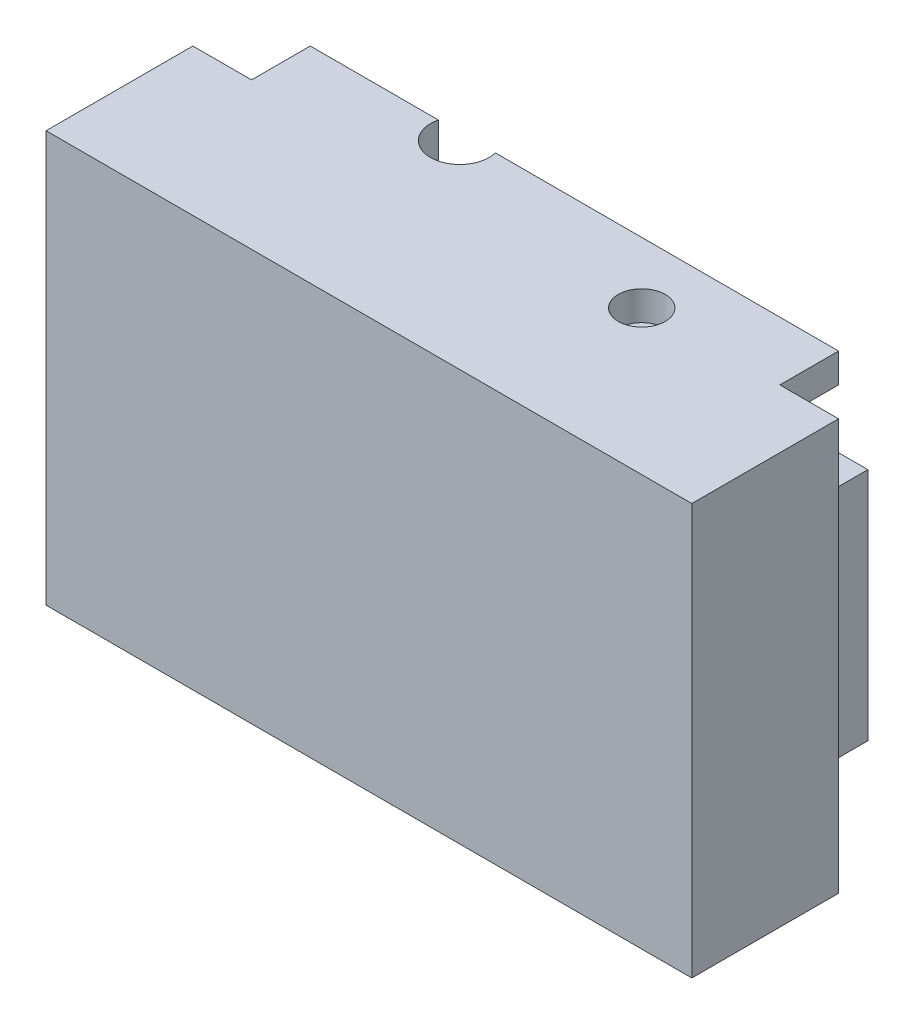
from build123d import *

# Parameters (mm, degrees)
SKETCH1_W           = 110
SKETCH1_H           = 70
BOSS_EXTRUDE1_DEPTH = 5
SKETCH2_W           = 90
SKETCH2_H           = 10
BOSS_EXTRUDE2_DEPTH = 20
BOSS_EXTRUDE5_DEPTH = 10
SKETCH7_R           = 5
CUT_EXTRUDE2_DEPTH  = 10
SKETCH8_R           = 4
CUT_EXTRUDE3_DEPTH  = 5
SKETCH9_W           = 5
SKETCH9_H           = 40
BOSS_EXTRUDE6_DEPTH = 10
SKETCH10_W          = 90
SKETCH10_H          = 10.075231777
BOSS_EXTRUDE7_DEPTH = 10
SKETCH11_W          = 40
SKETCH11_H          = 10
CUT_EXTRUDE4_DEPTH  = 5


with BuildPart() as part:
    # Sketch1 → Boss-Extrude1 (new body)
    with BuildSketch(Plane.XY):
        with Locations((55, 35)):
            Rectangle(SKETCH1_W, SKETCH1_H)
    extrude(amount=BOSS_EXTRUDE1_DEPTH)

    # Sketch2 → Boss-Extrude2 (add)
    with BuildSketch(Plane(origin=(0, 0, 0), x_dir=(-1, 0, 0), z_dir=(0, 0, -1))):
        with Locations((-55, 65)):
            Rectangle(SKETCH2_W, SKETCH2_H)
        Polygon((-100, 70), (-110, 70), (-110, 0), (-100, 0), (-100, 10), (-100, 60), align=None)
        Polygon((0, 70), (-10, 70), (-10, 60), (-10, 10), (-10, 0), (0, 0), align=None)
        with Locations((-55, 5)):
            Rectangle(SKETCH2_W, SKETCH2_H)
    extrude(amount=BOSS_EXTRUDE2_DEPTH)

    # Sketch6 → Boss-Extrude5 (add)
    with BuildSketch(Plane(origin=(0, 0, -20), x_dir=(-1, 0, 0), z_dir=(0, 0, -1))):
        Polygon((-45, 60), (-30, 60), (-30, 65), (-10, 65), (-10, 70), (-100, 70), (-100, 65), (-85, 65), (-85, 60), (-65, 60), (-65, 65), (-45, 65), align=None)
    extrude(amount=BOSS_EXTRUDE5_DEPTH)

    # Sketch7 → Cut-Extrude2 (cut)
    with BuildSketch(Plane(origin=(0, 70, 0), x_dir=(1, 0, 0), z_dir=(0, 1, 0))):
        with Locations((36.69, 28.79)):
            Circle(SKETCH7_R)
    extrude(amount=-CUT_EXTRUDE2_DEPTH, mode=Mode.SUBTRACT)

    # Sketch8 → Cut-Extrude3 (cut)
    with BuildSketch(Plane(origin=(0, 70, 0), x_dir=(1, 0, 0), z_dir=(0, 1, 0))):
        with Locations(Location((76.88, 19.59, 0), (0, 0, 270))):
            Circle(SKETCH8_R)
    extrude(amount=-CUT_EXTRUDE3_DEPTH, mode=Mode.SUBTRACT)

    # Sketch9 → Boss-Extrude6 (add)
    with BuildSketch(Plane(origin=(0, 0, -20), x_dir=(-1, 0, 0), z_dir=(0, 0, -1))):
        with Locations((-102.5, 35)):
            Rectangle(SKETCH9_W, SKETCH9_H)
        with Locations((-7.5, 35)):
            Rectangle(SKETCH9_W, SKETCH9_H)
    extrude(amount=BOSS_EXTRUDE6_DEPTH)

    # Sketch10 → Boss-Extrude7 (add)
    with BuildSketch(Plane(origin=(0, 0, -20), x_dir=(-1, 0, 0), z_dir=(0, 0, -1))):
        with Locations((-55, 4.962384111)):
            Rectangle(SKETCH10_W, SKETCH10_H)
    extrude(amount=BOSS_EXTRUDE7_DEPTH)

    # Sketch11 → Cut-Extrude4 (cut)
    with BuildSketch(Plane(origin=(0, 10, 0), x_dir=(1, 0, 0), z_dir=(0, 1, 0))):
        with Locations((55, 25)):
            Rectangle(SKETCH11_W, SKETCH11_H)
    extrude(amount=-CUT_EXTRUDE4_DEPTH, mode=Mode.SUBTRACT)


solid = part.part
